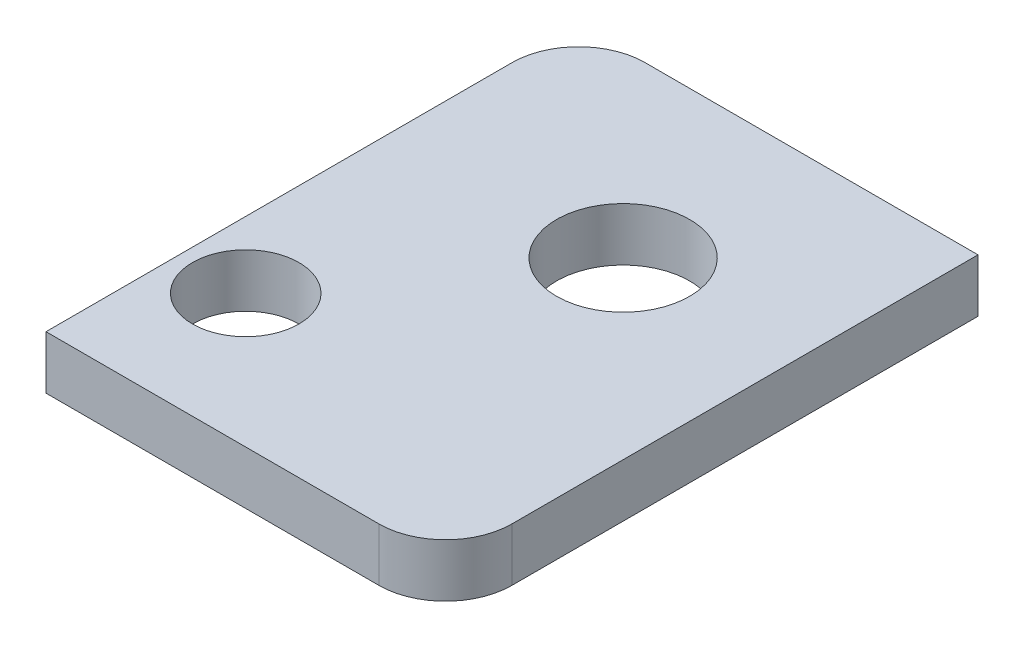
from build123d import *

# Parameters (mm, degrees)
SKETCH1_R           = 4
SKETCH1_R_2         = 5
BOSS_EXTRUDE1_DEPTH = 4


with BuildPart() as part:
    # Sketch1 → Boss-Extrude1 (new body)
    with BuildSketch(Plane(origin=(0, 0, 0), x_dir=(1, 0, 0), z_dir=(0, 1, 0))):
        with BuildLine():
            Line((0, 0), (0, 35))
            ThreePointArc((0, 35), (1.464466094, 38.535533906), (5, 40))
            Line((5, 40), (30, 40))
            Line((30, 40), (30, 5))
            ThreePointArc((30, 5), (28.535533906, 1.464466094), (25, 0))
            Line((25, 0), (0, 0))
        make_face()
        with Locations(Location((5, 10, 0), (0, 0, 270))):
            Circle(SKETCH1_R, mode=Mode.SUBTRACT)
        with Locations(Location((16.872624387, 26.473934758, 0), (0, 0, 270))):
            Circle(SKETCH1_R_2, mode=Mode.SUBTRACT)
    extrude(amount=BOSS_EXTRUDE1_DEPTH)


solid = part.part
